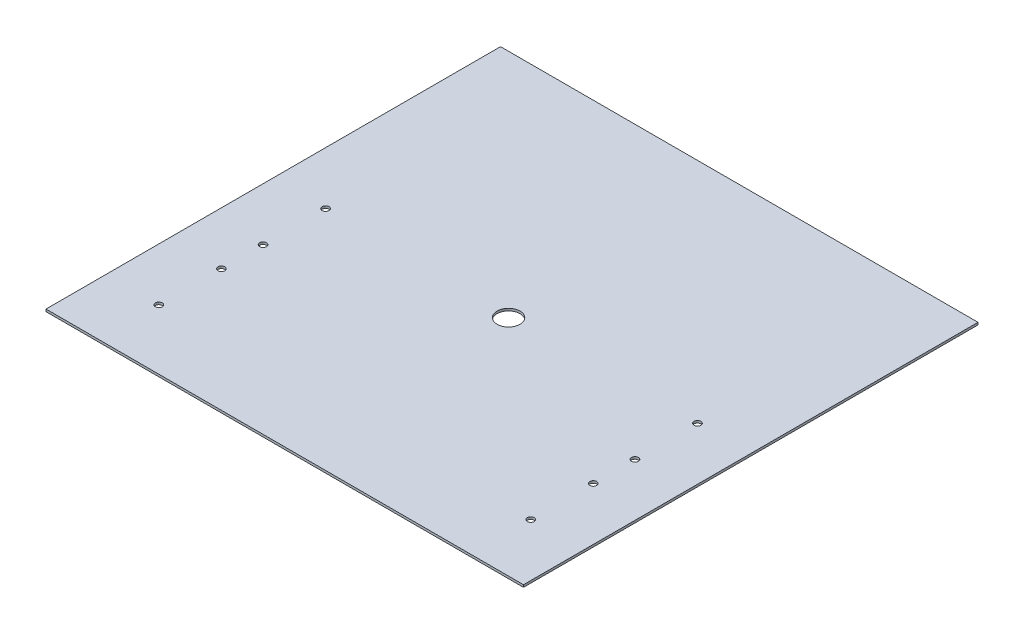
from build123d import *

# Parameters (mm, degrees)
SKETCH1_W           = 208
SKETCH1_H           = 198
BOSS_EXTRUDE1_DEPTH = 1
INPUT_FOR_SPEAKER_R = 5
CUT_EXTRUDE1_DEPTH  = 10
SKETCH4_R           = 1.5
CUT_EXTRUDE2_DEPTH  = 1


with BuildPart() as part:
    # Sketch1 → Boss-Extrude1 (new body)
    with BuildSketch(Plane(origin=(0, 0, 0), x_dir=(1, 0, 0), z_dir=(0, 1, 0))):
        with Locations((104, 99)):
            Rectangle(SKETCH1_W, SKETCH1_H)
    extrude(amount=BOSS_EXTRUDE1_DEPTH)

    # Input for speaker → Cut-Extrude1 (cut)
    with BuildSketch(Plane(origin=(0, 1, 0), x_dir=(1, 0, 0), z_dir=(0, 1, 0))):
        with Locations(Location((104, 97.5, 0), (0, 0, 270))):
            Circle(INPUT_FOR_SPEAKER_R)
    extrude(amount=-CUT_EXTRUDE1_DEPTH, mode=Mode.SUBTRACT)

    # Sketch4 → Cut-Extrude2 (cut)
    with BuildSketch(Plane(origin=(0, 0, 0), x_dir=(-1, 0, 0), z_dir=(0, -1, 0))):
        with Locations(Location((-185, 98.797761971, 0), (0, 0, 90))):
            Circle(SKETCH4_R)
        with Locations(Location((-185, 71.557761971, 0), (0, 0, 90))):
            Circle(SKETCH4_R)
        with Locations(Location((-185, 53.4, 0), (0, 0, 90))):
            Circle(SKETCH4_R)
        with Locations(Location((-185, 26.16, 0), (0, 0, 90))):
            Circle(SKETCH4_R)
        with Locations(Location((-23, 26.16, 0), (0, 0, 270))):
            Circle(SKETCH4_R)
        with Locations(Location((-23, 53.4, 0), (0, 0, 270))):
            Circle(SKETCH4_R)
        with Locations(Location((-23, 71.557761971, 0), (0, 0, 270))):
            Circle(SKETCH4_R)
        with Locations(Location((-23, 98.797761971, 0), (0, 0, 270))):
            Circle(SKETCH4_R)
    extrude(amount=-CUT_EXTRUDE2_DEPTH, mode=Mode.SUBTRACT)


solid = part.part
